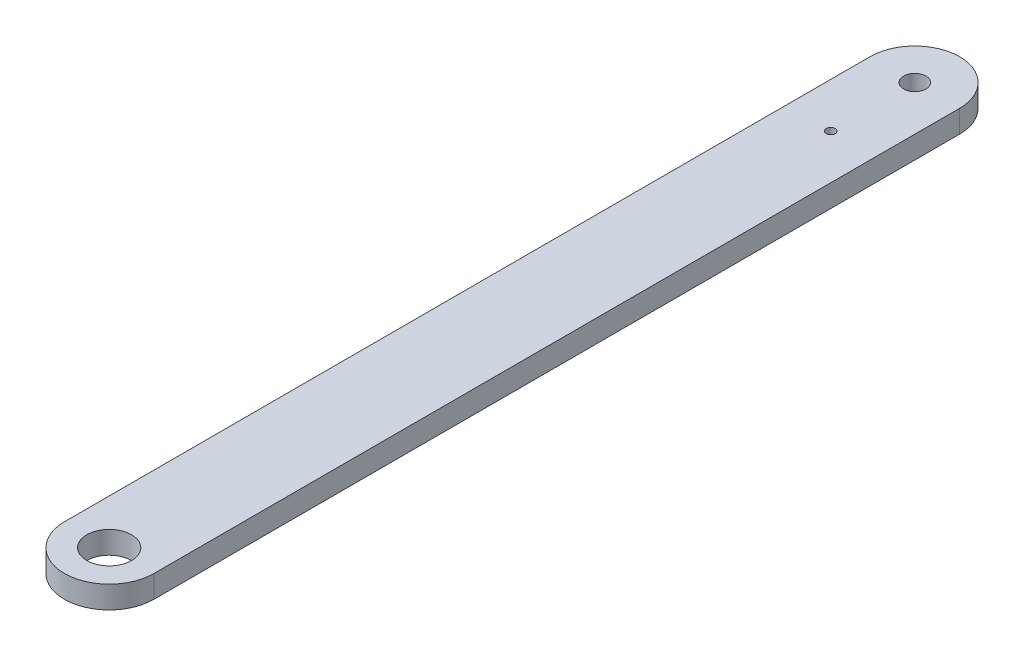
from build123d import *

# Parameters (mm, degrees)
SKETCH1_R           = 2.5
BOSS_EXTRUDE1_DEPTH = 5
SKETCH2_R           = 1
CUT_EXTRUDE1_DEPTH  = 101.623058987
SKETCH3_R           = 5
BEARINGBORE_DEPTH   = 101.623058987


with BuildPart() as part:
    # Sketch1 → Boss-Extrude1 (new body)
    with BuildSketch(Plane(origin=(0, 0, 0), x_dir=(1, 0, 0), z_dir=(0, 1, 0))):
        with BuildLine():
            Line((-10, -90), (-10, 90))
            ThreePointArc((-10, 90), (0, 100), (10, 90))
            Line((10, 90), (10, -90))
            ThreePointArc((10, -90), (0, -100), (-10, -90))
        make_face()
        with Locations(Location((0, 90, 0), (0, 0, 270))):
            Circle(SKETCH1_R, mode=Mode.SUBTRACT)
    extrude(amount=BOSS_EXTRUDE1_DEPTH)

    # Sketch2 → Cut-Extrude1 (cut, through all)
    with BuildSketch(Plane.XZ):
        with Locations(Location((0, -71.209904471, 0), (0, 0, 270))):
            Circle(SKETCH2_R)
    extrude(amount=-CUT_EXTRUDE1_DEPTH, mode=Mode.SUBTRACT)

    # Sketch3 → BearingBore (cut, through all)
    with BuildSketch(Plane(origin=(0, 5, 0), x_dir=(1, 0, 0), z_dir=(0, 1, 0))):
        with Locations(Location((0, -90, 0), (0, 0, 270))):
            Circle(SKETCH3_R)
    extrude(amount=-BEARINGBORE_DEPTH, mode=Mode.SUBTRACT)


solid = part.part
